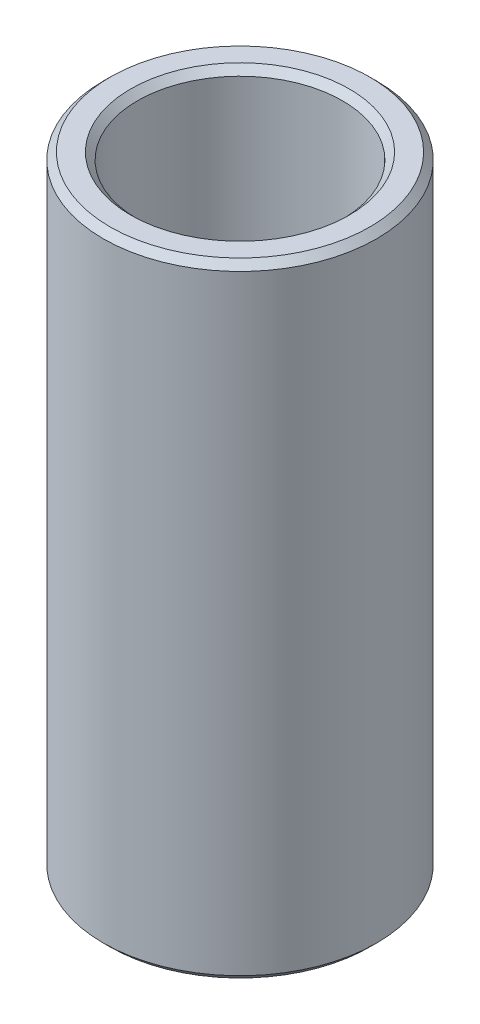
from build123d import *

# Parameters (mm, degrees)
SKIZZE1_R                       = 4
SKIZZE1_R_2                     = 3
AUFSATZ_LINEAR_AUSTRAGEN1_DEPTH = 18.25
FASE1_SIZE                      = 0.2


with BuildPart() as part:
    # Skizze1 → Aufsatz-Linear austragen1 (new body)
    with BuildSketch(Plane(origin=(0, 0, 0), x_dir=(1, 0, 0), z_dir=(0, 1, 0))):
        with Locations(Location((0, 0, 0), (0, 0, 270))):
            Circle(SKIZZE1_R)
        with Locations(Location((0, 0, 0), (0, 0, 270))):
            Circle(SKIZZE1_R_2, mode=Mode.SUBTRACT)
    extrude(amount=AUFSATZ_LINEAR_AUSTRAGEN1_DEPTH)

    # Fase1
    fase1_edges = [part.edges().sort_by_distance(p)[0] for p in [
        (0, 0, -4),
        (0, 18.25, -4),
        (0, 0, -3),
        (0, 18.25, -3),
    ]]
    chamfer(fase1_edges, length=FASE1_SIZE)


solid = part.part
